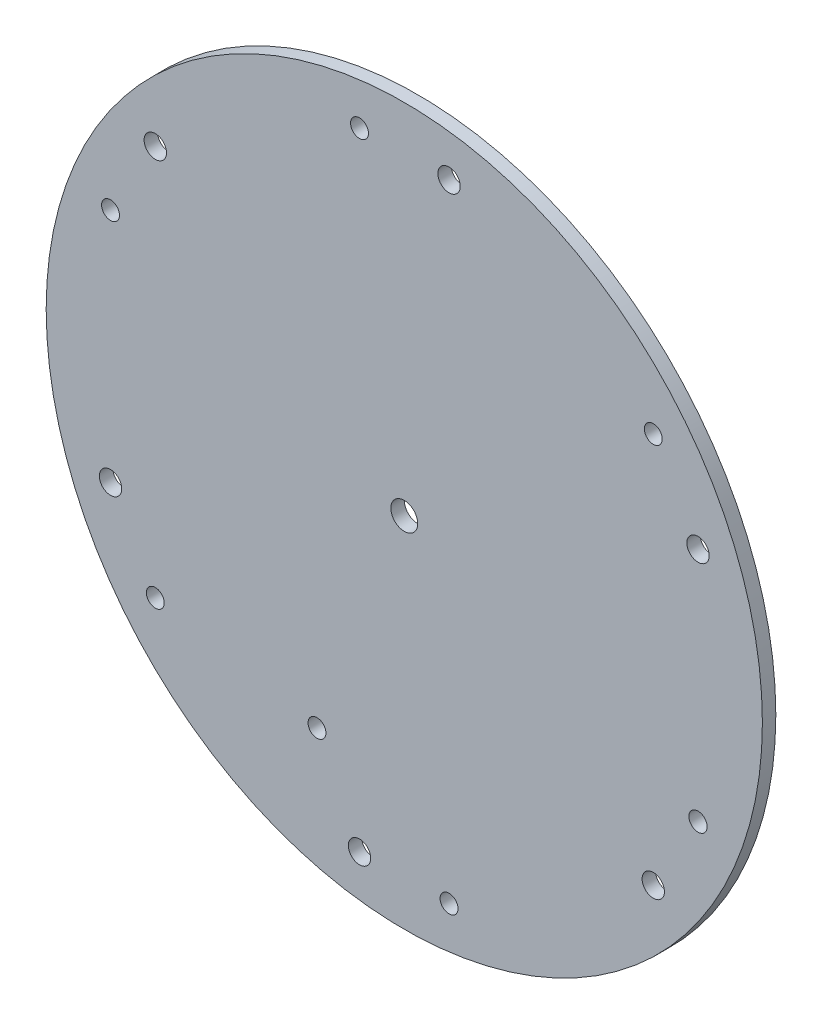
from build123d import *

# Parameters (mm, degrees)
SKETCH_1_R      = 80
SKETCH_1_R_2    = 3
SKETCH_1_R_3    = 2
SKETCH_1_R_4    = 2.5
SKETCH_1_R_5    = 2.039490197
EXTRUDE_1_DEPTH = 3


with BuildPart() as part:
    # ｽｹｯﾁ1 → ﾎﾞｽ - 押し出し1 (new body)
    with BuildSketch(Plane.XY):
        with Locations((2197.593788105, 1488.615324608)):
            Circle(SKETCH_1_R)
        with Locations((2197.593788105, 1488.615324608)):
            Circle(SKETCH_1_R_2, mode=Mode.SUBTRACT)
        with Locations((2187.593788105, 1558.615324608)):
            Circle(SKETCH_1_R_3, mode=Mode.SUBTRACT)
        with Locations((2141.97200984, 1532.275578646)):
            Circle(SKETCH_1_R_4, mode=Mode.SUBTRACT)
        with Locations((2207.593788105, 1558.615324608)):
            Circle(SKETCH_1_R_4, mode=Mode.SUBTRACT)
        with Locations((2131.97200984, 1514.95507057)):
            Circle(SKETCH_1_R_3, mode=Mode.SUBTRACT)
        with Locations((2131.97200984, 1462.275578646)):
            Circle(SKETCH_1_R_4, mode=Mode.SUBTRACT)
        with Locations((2141.97200984, 1444.95507057)):
            Circle(SKETCH_1_R_3, mode=Mode.SUBTRACT)
        with Locations((2178.093788105, 1437.836228836)):
            Circle(SKETCH_1_R_3, mode=Mode.SUBTRACT)
        with Locations((2187.593788105, 1418.615324608)):
            Circle(SKETCH_1_R_4, mode=Mode.SUBTRACT)
        with Locations((2207.593788105, 1418.615324608)):
            Circle(SKETCH_1_R_3, mode=Mode.SUBTRACT)
        with Locations((2253.21556637, 1444.95507057)):
            Circle(SKETCH_1_R_4, mode=Mode.SUBTRACT)
        with Locations((2263.21556637, 1462.275578646)):
            Circle(SKETCH_1_R_5, mode=Mode.SUBTRACT)
        with Locations((2263.21556637, 1514.95507057)):
            Circle(SKETCH_1_R_4, mode=Mode.SUBTRACT)
        with Locations((2253.21556637, 1532.275578646)):
            Circle(SKETCH_1_R_3, mode=Mode.SUBTRACT)
    extrude(amount=EXTRUDE_1_DEPTH)


solid = part.part
